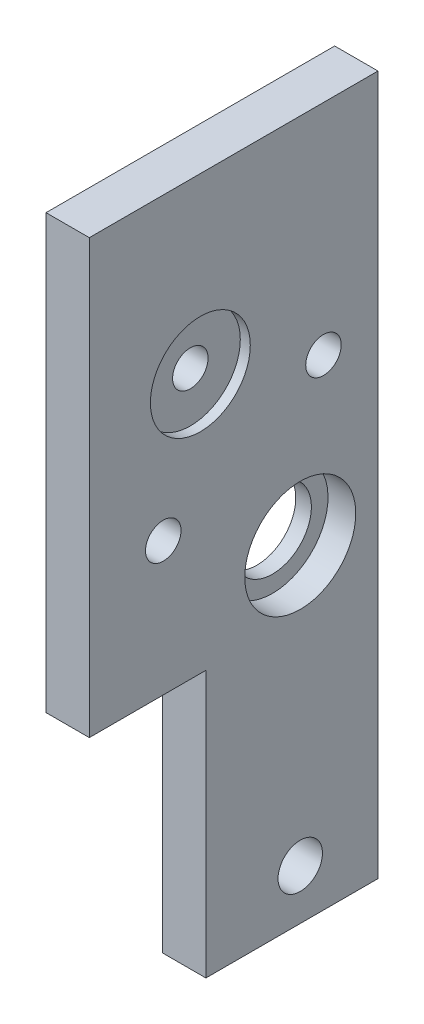
from build123d import *

# Parameters (mm, degrees)
SKETCH1_W                                        = 30
SKETCH1_H                                        = 63
BOSS_EXTRUDE1_DEPTH                              = 4
SKETCH2_R                                        = 5
CUT_EXTRUDE1_DEPTH                               = 70.89277502
F_4_0_4_DIAMETER_HOLE1_D                         = 4
SKETCH12_W                                       = 14.5
SKETCH12_H                                       = 24
CUT_EXTRUDE2_DEPTH                               = 70.89277502
SKETCH13_W                                       = 42.673617324
SKETCH13_H                                       = 65.779819875
CUT_EXTRUDE5_DEPTH                               = 4
F_4_0_4_DIAMETER_HOLE6_D                         = 4
CBORE_FOR_M3_PAN_HEAD_MACHINE_SCREW7_D           = 3.2
CBORE_FOR_M3_PAN_HEAD_MACHINE_SCREW7_CBORE_D     = 9
CBORE_FOR_M3_PAN_HEAD_MACHINE_SCREW7_CBORE_DEPTH = 1
CSK_FOR_M3_FLAT_HEAD_MACHINE_SCREW1_D            = 3.2
CSK_FOR_M3_FLAT_HEAD_MACHINE_SCREW1_CSINK_D      = 4
CSK_FOR_M3_FLAT_HEAD_MACHINE_SCREW1_CSINK_ANGLE  = 90
CUT_EXTRUDE6_DEPTH                               = 70.89277502
CUT_EXTRUDE6_DEPTH_BACK                          = 70.89277502
SKETCH45_W                                       = 4
SKETCH45_H                                       = 39
SKETCH46_W                                       = 0.1
SKETCH46_H                                       = 63
CUT_EXTRUDE7_DEPTH                               = 69.271516755
BOSS_EXTRUDE2_START                              = -1.4
SKETCH47_R                                       = 5
SKETCH47_R_2                                     = 3.5
BOSS_EXTRUDE2_DEPTH                              = 1.4


with BuildPart() as part:
    # Sketch1 → Boss-Extrude1 (new body)
    with BuildSketch(Plane(origin=(0, 0, 0), x_dir=(0, 0, -1), z_dir=(1, 0, 0))):
        with Locations((-15, 31.5)):
            Rectangle(SKETCH1_W, SKETCH1_H)
    boss_extrude1 = extrude(amount=-BOSS_EXTRUDE1_DEPTH)

    # Sketch2 → Cut-Extrude1 (cut, through all)
    with BuildSketch(Plane(origin=(0, 0, 0), x_dir=(0, 0, -1), z_dir=(1, 0, 0))):
        with Locations((-7, 29.5)):
            Circle(SKETCH2_R)
    cut_extrude1 = extrude(amount=-CUT_EXTRUDE1_DEPTH, mode=Mode.SUBTRACT)

    # Ø4.0 (4) Diameter Hole1 (through all)
    with Locations(Plane(origin=(0, 4.5, 7), x_dir=(0, 0, 1), z_dir=(1, 0, 0))):
        with Locations((0, 0)):
            Hole(F_4_0_4_DIAMETER_HOLE1_D / 2)

    # Sketch12 → Cut-Extrude2 (cut, through all)
    with BuildSketch(Plane(origin=(0, 0, 0), x_dir=(0, 0, -1), z_dir=(1, 0, 0))):
        with Locations((-22.75, 12)):
            Rectangle(SKETCH12_W, SKETCH12_H)
    cut_extrude2 = extrude(amount=-CUT_EXTRUDE2_DEPTH, mode=Mode.SUBTRACT)

    # Mirror7: Boss-Extrude1, Cut-Extrude1, Cut-Extrude2 across plane
    add(boss_extrude1.mirror(Plane(origin=(0, 0, 0), x_dir=(0, 0, 1), z_dir=(1, 0, 0))))
    add(cut_extrude1.mirror(Plane(origin=(0, 0, 0), x_dir=(0, 0, 1), z_dir=(1, 0, 0))), mode=Mode.SUBTRACT)
    add(cut_extrude2.mirror(Plane(origin=(0, 0, 0), x_dir=(0, 0, 1), z_dir=(1, 0, 0))), mode=Mode.SUBTRACT)

    # Sketch13 → Cut-Extrude5 (cut)
    with BuildSketch(Plane.ZY.offset(4)):
        with Locations((15.520409967, 30.110090063)):
            Rectangle(SKETCH13_W, SKETCH13_H)
    extrude(amount=-CUT_EXTRUDE5_DEPTH, mode=Mode.SUBTRACT)

    # Ø4.0 (4) Diameter Hole6 (through all)
    with Locations(Plane(origin=(0, 4.5, 7), x_dir=(0, 0, -1), z_dir=(-1, 0, 0))):
        with Locations((0, 0)):
            Hole(F_4_0_4_DIAMETER_HOLE6_D / 2)

    # CBORE for M3 Pan Head Machine Screw7 (through all)
    with Locations(Plane(origin=(4, 47.360571099, 16), x_dir=(0, 0, 1), z_dir=(1, 0, 0))):
        with Locations((0, 0)):
            CounterBoreHole(CBORE_FOR_M3_PAN_HEAD_MACHINE_SCREW7_D / 2, CBORE_FOR_M3_PAN_HEAD_MACHINE_SCREW7_CBORE_D / 2, CBORE_FOR_M3_PAN_HEAD_MACHINE_SCREW7_CBORE_DEPTH)

    # CSK for M3 Flat Head Machine Screw1 (through all)
    with Locations(Plane(origin=(0, 36.032608687, 19.33966579), x_dir=(0, 0, -1), z_dir=(-1, 0, 0))):
        with Locations((0, 0), (14.431341448, -7.272)):
            CounterSinkHole(CSK_FOR_M3_FLAT_HEAD_MACHINE_SCREW1_D / 2, CSK_FOR_M3_FLAT_HEAD_MACHINE_SCREW1_CSINK_D / 2, counter_sink_angle=CSK_FOR_M3_FLAT_HEAD_MACHINE_SCREW1_CSINK_ANGLE)

    # Sketch45 → Cut-Extrude6 (cut, two sides: drawn at the far end of the back side and taken through both)
    with BuildSketch(Plane(origin=(4, 0, 0), x_dir=(0, 0, -1), z_dir=(1, 0, 0)).offset(-CUT_EXTRUDE6_DEPTH_BACK)):
        with Locations((-28, 43.5)):
            Rectangle(SKETCH45_W, SKETCH45_H)
    extrude(amount=CUT_EXTRUDE6_DEPTH + CUT_EXTRUDE6_DEPTH_BACK, mode=Mode.SUBTRACT)

    # Sketch46 → Cut-Extrude7 (cut, through all)
    with BuildSketch(Plane(origin=(0, 0, 0), x_dir=(-1, 0, 0), z_dir=(0, 0, -1))):
        with Locations((-3.95, 31.5)):
            Rectangle(SKETCH46_W, SKETCH46_H)
    extrude(amount=-CUT_EXTRUDE7_DEPTH, mode=Mode.SUBTRACT)

    # Sketch47 → Boss-Extrude2 (add)
    with BuildSketch(Plane.ZY.offset(BOSS_EXTRUDE2_START)):
        with Locations(Location((7, 29.5, 0), (0, 0, 270))):
            Circle(SKETCH47_R)
        with Locations((7, 29.5)):
            Circle(SKETCH47_R_2, mode=Mode.SUBTRACT)
    extrude(amount=BOSS_EXTRUDE2_DEPTH)


solid = part.part
